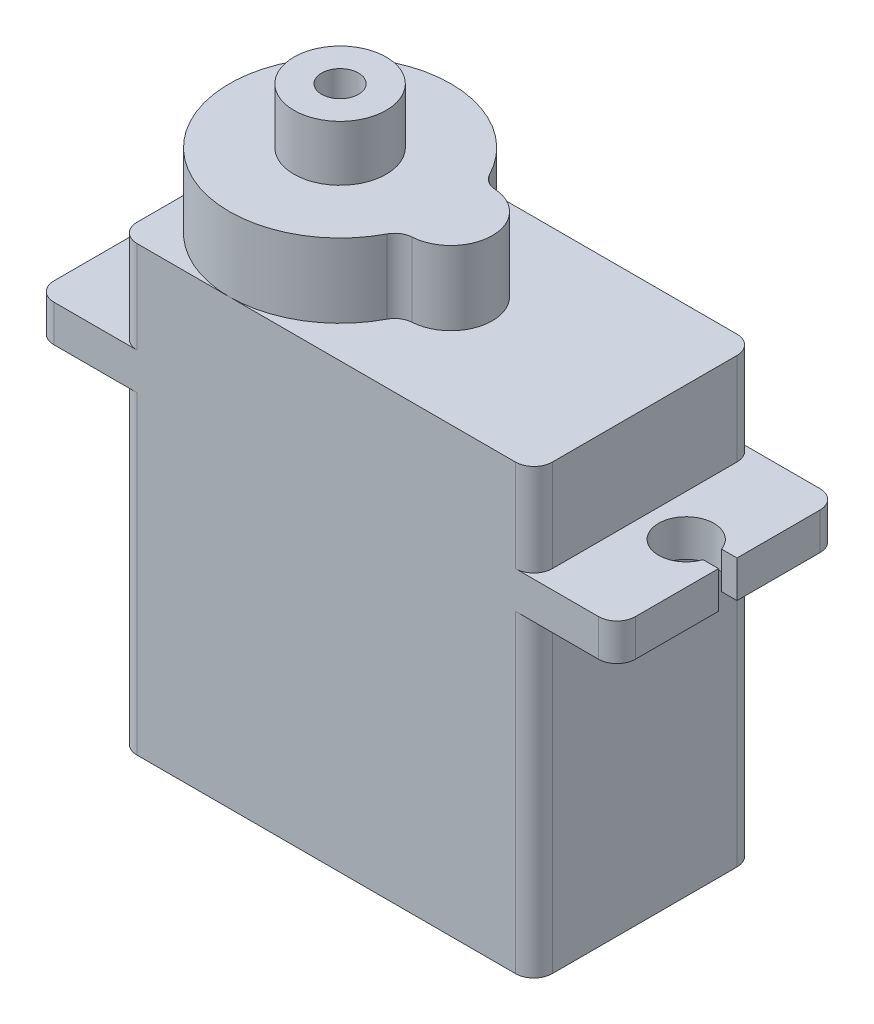
from build123d import *

# Parameters (mm, degrees)
EXTRUDE_1_DEPTH     = 12
EXTRUDE_2_DEPTH     = 4
CUT_EXTRUDE_1_DEPTH = 28.441984258
SKETCH_4_R          = 2.5
EXTRUDE_3_DEPTH     = 3
FILLET_1_R          = 1
FILLET_2_R          = 1
FILLET_3_R          = 1
SKETCH_5_R          = 1
CUT_EXTRUDE_2_DEPTH = 3
SKETCH_6_W          = 1
SKETCH_6_H          = 3
CUT_EXTRUDE_3_DEPTH = 4.5


with BuildPart() as part:
    # 草图1 → 凸台-拉伸1 (new body)
    with BuildSketch(Plane.XY):
        Polygon((-11.25, -12), (11.25, -12), (11.25, 5), (15.75, 5), (15.75, 7), (11.25, 7), (11.25, 12), (-11.25, 12), (-11.25, 7), (-15.75, 7), (-15.75, 5), (-11.25, 5), align=None)
    extrude(amount=EXTRUDE_1_DEPTH)

    # 草图2 → 凸台-拉伸2 (add)
    with BuildSketch(Plane(origin=(0, 12, 0), x_dir=(1, 0, 0), z_dir=(0, 1, 0))):
        with BuildLine():
            ThreePointArc((0.328125, -3.789904644), (-11.25, -6), (0.328125, -8.210095356))
            ThreePointArc((0.328125, -8.210095356), (3, -6), (0.328125, -3.789904644))
        make_face()
    extrude(amount=EXTRUDE_2_DEPTH)

    # 草图3 → 切除-拉伸1 (cut, through all)
    with BuildSketch(Plane(origin=(0, 7, 0), x_dir=(1, 0, 0), z_dir=(0, 1, 0))):
        with BuildLine():
            Line((15.75, -6.5), (14.914213562, -6.5))
            ThreePointArc((14.914213562, -6.5), (12, -6), (14.914213562, -5.5))
            Line((14.914213562, -5.5), (15.75, -5.5))
            Line((15.75, -5.5), (15.75, -6.5))
        make_face()
        with BuildLine():
            Line((-15.75, -5.5), (-14.914213562, -5.5))
            ThreePointArc((-14.914213562, -5.5), (-12, -6), (-14.914213562, -6.5))
            Line((-14.914213562, -6.5), (-15.75, -6.5))
            Line((-15.75, -6.5), (-15.75, -5.5))
        make_face()
    extrude(amount=-CUT_EXTRUDE_1_DEPTH, mode=Mode.SUBTRACT)

    # 草图4 → 凸台-拉伸3 (add)
    with BuildSketch(Plane(origin=(0, 16, 0), x_dir=(1, 0, 0), z_dir=(0, 1, 0))):
        with Locations(Location((-5.25, -6, 0), (0, 0, 270))):
            Circle(SKETCH_4_R)
    extrude(amount=EXTRUDE_3_DEPTH)

    # 圆角1
    fillet_1_edges = [part.edges().sort_by_distance(p)[0] for p in [
        (15.75, 6, 0),
        (-15.75, 6, 0),
        (-15.75, 6, 12),
        (15.75, 6, 12),
    ]]
    fillet(fillet_1_edges, radius=FILLET_1_R)

    # 圆角2
    fillet_2_edges = [part.edges().sort_by_distance(p)[0] for p in [
        (-11.25, 9.5, 12),
        (11.25, -3.5, 0),
        (-11.25, -3.5, 0),
        (-11.25, 9.5, 0),
        (11.25, 9.5, 0),
        (-11.25, -3.5, 12),
        (11.25, -3.5, 12),
        (11.25, 9.5, 12),
    ]]
    fillet(fillet_2_edges, radius=FILLET_2_R)

    # 圆角3
    fillet_3_edges = [part.edges().sort_by_distance(p)[0] for p in [
        (0.328125, 14, 8.210095356),
        (0.328125, 14, 3.789904644),
    ]]
    fillet(fillet_3_edges, radius=FILLET_3_R)

    # 草图5 → 切除-拉伸2 (cut)
    with BuildSketch(Plane(origin=(0, 19, 0), x_dir=(1, 0, 0), z_dir=(0, 1, 0))):
        with Locations(Location((-5.25, -6, 0), (0, 0, 270))):
            Circle(SKETCH_5_R)
    extrude(amount=-CUT_EXTRUDE_2_DEPTH, mode=Mode.SUBTRACT)

    # 草图6 → 切除-拉伸3 (cut)
    with BuildSketch(Plane.XZ.offset(12)):
        with Locations((-10.75, 6)):
            Rectangle(SKETCH_6_W, SKETCH_6_H)
    extrude(amount=-CUT_EXTRUDE_3_DEPTH, mode=Mode.SUBTRACT)


solid = part.part
